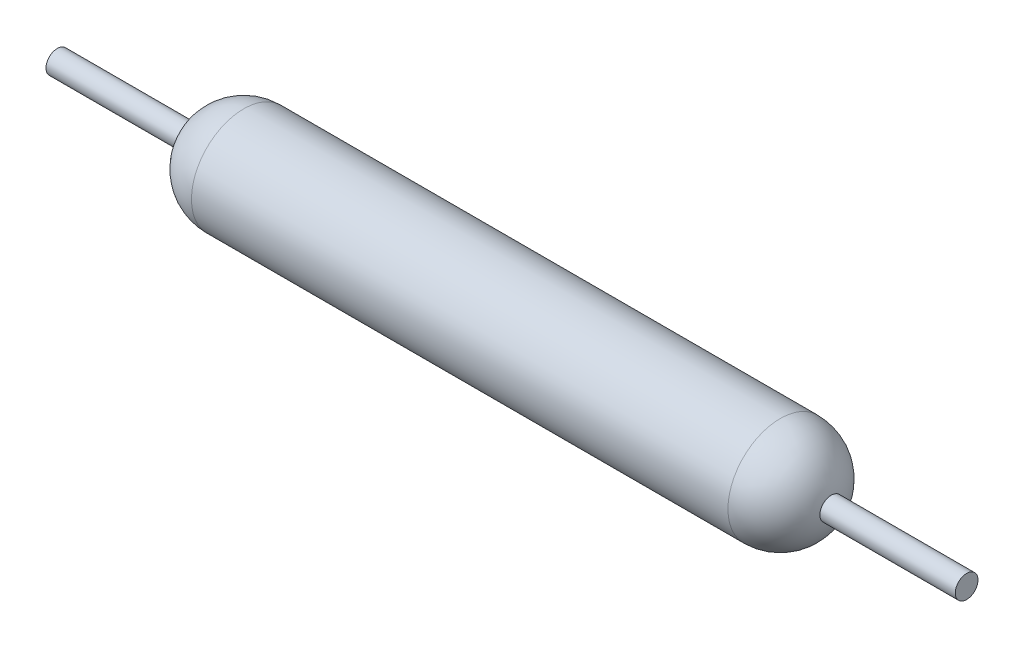
from build123d import *

# Parameters (mm, degrees)
SKETCH1_R                = 1.15
BOSS_EXTRUDE1_DEPTH      = 7.05
FILLET1_R                = 1.15
FILLET1_OF_MIRROR3_R     = 1.15
SHELL2_T                 = 0.1
BOSS_EXTRUDE2_DEPTH      = 2
BOSS_EXTRUDE2_DEPTH_BACK = 6.1
SKETCH2_W                = 1.5
SKETCH2_H                = 0.1
BOSS_EXTRUDE3_DEPTH      = 6.1
BOSS_EXTRUDE3_DEPTH_BACK = 2
SKETCH4_W                = 1.5
SKETCH4_H                = 0.1
SKETCH5_R                = 0.25
BOSS_EXTRUDE4_DEPTH      = 5
BOSS_EXTRUDE5_START      = 5
SKETCH6_R                = 0.25
BOSS_EXTRUDE5_DEPTH      = 5


with BuildPart() as part:
    # Sketch1 → Boss-Extrude1 (new body)
    with BuildSketch(Plane(origin=(0, 0, 0), x_dir=(0, 0, -1), z_dir=(1, 0, 0))):
        Circle(SKETCH1_R)
    boss_extrude1 = extrude(amount=BOSS_EXTRUDE1_DEPTH)

    # Fillet1
    fillet1_edges = [part.edges().sort_by_distance(p)[0] for p in [
        (7.05, 0, 1.15),
    ]]
    fillet(fillet1_edges, radius=FILLET1_R)

    # Mirror3: Boss-Extrude1 across Right Plane
    add(boss_extrude1.mirror(Plane(origin=(0, 0, 0), x_dir=(0, 0, -1), z_dir=(1, 0, 0))))

    # Fillet1 of Mirror3
    fillet1_of_mirror3_edges = [part.edges().sort_by_distance(p)[0] for p in [
        (-7.05, 0, 1.15),
    ]]
    fillet(fillet1_of_mirror3_edges, radius=FILLET1_OF_MIRROR3_R)

    # Shell2 (no face opened: a closed hollow body)
    add(offset(amount=-SHELL2_T, mode=Mode.PRIVATE), mode=Mode.SUBTRACT)

    # Sketch5 → Boss-Extrude4 (add)
    with BuildSketch(Plane(origin=(-5, 0, 0), x_dir=(0, 0, -1), z_dir=(1, 0, 0))):
        Circle(SKETCH5_R)
    extrude(amount=-BOSS_EXTRUDE4_DEPTH)

    # Sketch6 → Boss-Extrude5 (add)
    with BuildSketch(Plane(origin=(5, 0, 0), x_dir=(0, 0, -1), z_dir=(1, 0, 0)).offset(BOSS_EXTRUDE5_START)):
        Circle(SKETCH6_R)
    extrude(amount=-BOSS_EXTRUDE5_DEPTH)


with BuildPart() as body_2:
    # Sketch2 → Boss-Extrude2 (new, two sides: drawn at the far end of the back side and taken through both)
    with BuildSketch(Plane(origin=(0, 0, 0), x_dir=(0, 0, -1), z_dir=(1, 0, 0)).offset(-BOSS_EXTRUDE2_DEPTH_BACK)):
        with Locations((0, 0.3)):
            Rectangle(SKETCH2_W, SKETCH2_H)
    extrude(amount=BOSS_EXTRUDE2_DEPTH + BOSS_EXTRUDE2_DEPTH_BACK)


with BuildPart() as body_3:
    # Sketch4 → Boss-Extrude3 (new, two sides: drawn at the far end of the back side and taken through both)
    with BuildSketch(Plane(origin=(0, 0, 0), x_dir=(0, 0, -1), z_dir=(1, 0, 0)).offset(-BOSS_EXTRUDE3_DEPTH_BACK)):
        with Locations((0, -0.3)):
            Rectangle(SKETCH4_W, SKETCH4_H)
    extrude(amount=BOSS_EXTRUDE3_DEPTH + BOSS_EXTRUDE3_DEPTH_BACK)


solid = Compound([part.part, body_2.part, body_3.part])
